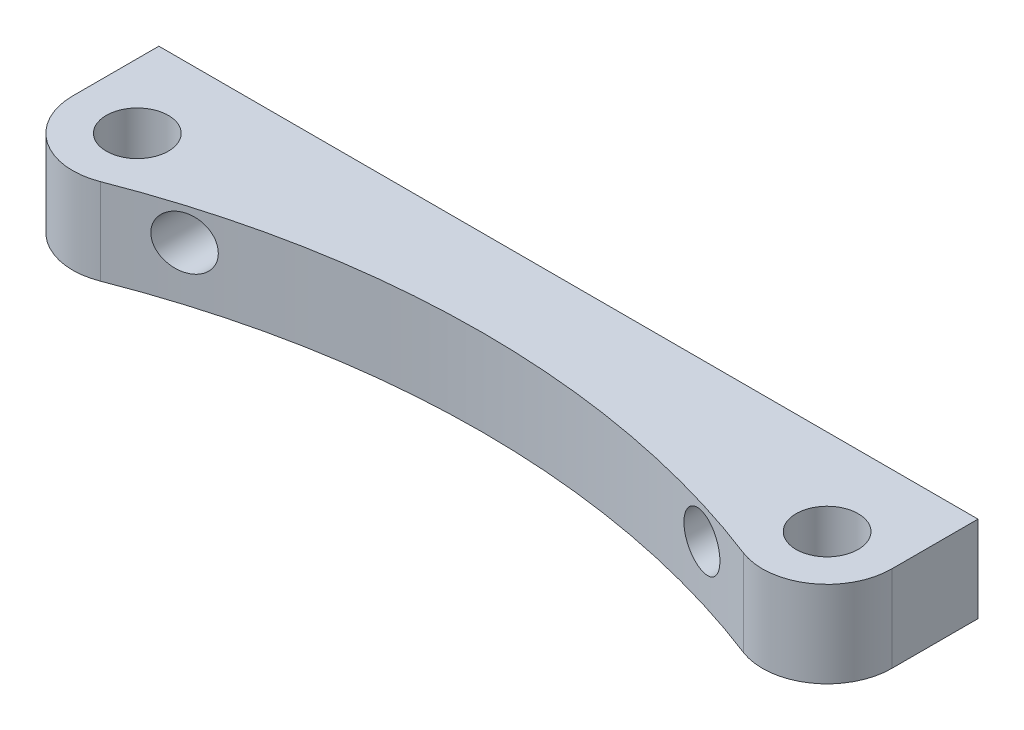
from build123d import *

# Parameters (mm, degrees)
SKETCH1_R               = 2.286
BOSS_EXTRUDE1_DEPTH     = 6.35
CUT_EXTRUDE1_REACH      = 59.018
CUT_EXTRUDE1_END_RADIUS = 65.352083333
SKETCH2_R               = 1.905


with BuildPart() as part:
    # Sketch1 → Boss-Extrude1 (new body)
    with BuildSketch(Plane(origin=(0, 0, 0), x_dir=(1, 0, 0), z_dir=(0, 1, 0))):
        with BuildLine():
            Line((-4.7625, 6.35), (-4.7625, 0))
            ThreePointArc((-4.7625, 0), (-2.689307148, -3.930525832), (1.725283019, -4.439009434))
            ThreePointArc((1.725283019, -4.439009434), (25.4, 0), (49.074716981, -4.439009434))
            ThreePointArc((49.074716981, -4.439009434), (53.489307148, -3.930525832), (55.5625, 0))
            Line((55.5625, 0), (55.5625, 6.35))
            Line((55.5625, 6.35), (-4.7625, 6.35))
        make_face()
        with Locations(Location((0, 0, 0), (0, 0, 270))):
            Circle(SKETCH1_R, mode=Mode.SUBTRACT)
        with Locations(Location((50.8, 0, 0), (0, 0, 270))):
            Circle(SKETCH1_R, mode=Mode.SUBTRACT)
    extrude(amount=BOSS_EXTRUDE1_DEPTH)

    # Cut-Extrude1: up to this cylinder (the profile starts outside it)
    cut_extrude1_end = Plane(origin=(25.4, 3.96875, 65.352083333), z_dir=(0, -1, 0)) * Cylinder(CUT_EXTRUDE1_END_RADIUS, 249.740166667, mode=Mode.PRIVATE)
    # Sketch2 → Cut-Extrude1 (cut, up to the surface)
    with BuildSketch(Plane(origin=(0, 0, -6.35), x_dir=(-1, 0, 0), z_dir=(0, 0, -1)), mode=Mode.PRIVATE) as cut_extrude1_sk1:
        with Locations((-6.35, 3.96875)):
            Circle(SKETCH2_R)
    cut_extrude1_tool1 = extrude(cut_extrude1_sk1.sketch, amount=-CUT_EXTRUDE1_REACH, mode=Mode.PRIVATE) - cut_extrude1_end
    add(cut_extrude1_tool1.solids().sort_by_distance((6.35, 3.96875, -6.35))[0], mode=Mode.SUBTRACT)
    # Sketch2 → Cut-Extrude1 (cut, up to the surface)
    with BuildSketch(Plane(origin=(0, 0, -6.35), x_dir=(-1, 0, 0), z_dir=(0, 0, -1)), mode=Mode.PRIVATE) as cut_extrude1_sk2:
        with Locations((-44.45, 3.96875)):
            Circle(SKETCH2_R)
    cut_extrude1_tool2 = extrude(cut_extrude1_sk2.sketch, amount=-CUT_EXTRUDE1_REACH, mode=Mode.PRIVATE) - cut_extrude1_end
    add(cut_extrude1_tool2.solids().sort_by_distance((44.45, 3.96875, -6.35))[0], mode=Mode.SUBTRACT)


solid = part.part
